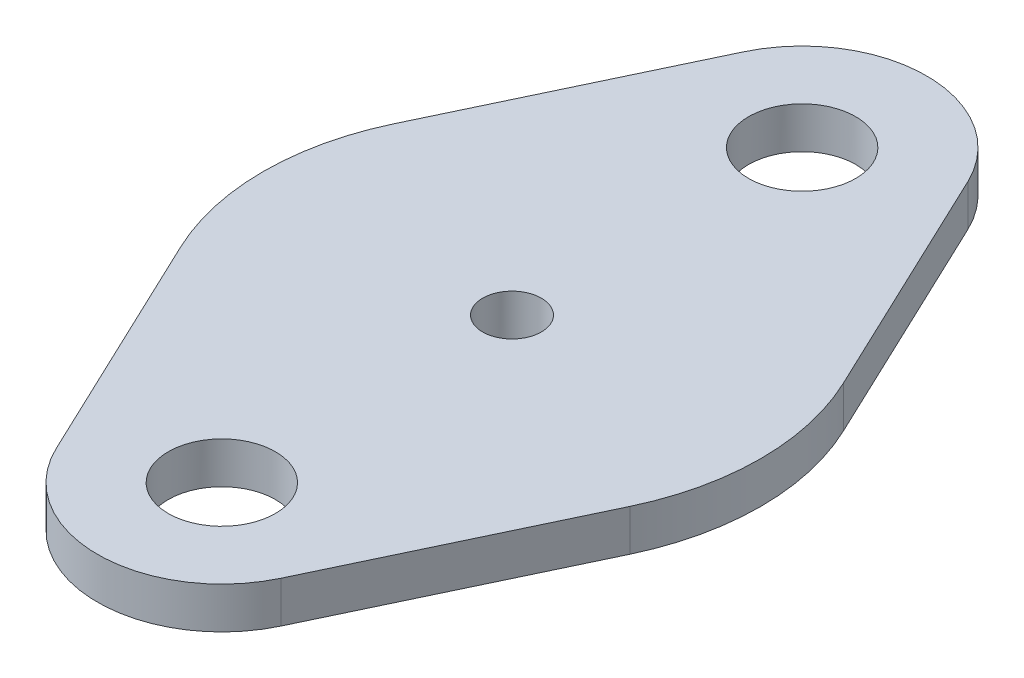
from build123d import *

# Parameters (mm, degrees)
SKETCH1_W                = 38.1
SKETCH1_H                = 63.5
BOSS_EXTRUDE1_DEPTH      = 3.175
F_8_CLEARANCE_HOLE1_D    = 4.4958
F_5_16_CLEARANCE_HOLE1_D = 8.2042
SKETCH6_W                = 40.64
SKETCH6_H                = 66.04
CUT_EXTRUDE1_DEPTH       = 3.175


with BuildPart() as part:
    # Sketch1 → Boss-Extrude1 (new body)
    with BuildSketch(Plane(origin=(0, 0, 0), x_dir=(1, 0, 0), z_dir=(0, 1, 0))):
        with Locations((19.05, 31.75)):
            Rectangle(SKETCH1_W, SKETCH1_H)
    extrude(amount=BOSS_EXTRUDE1_DEPTH)

    # #8 Clearance Hole1 (through all)
    with Locations(Plane(origin=(0, 3.175, 0), x_dir=(1, 0, 0), z_dir=(0, 1, 0))):
        with Locations((19.05, 31.75)):
            Hole(F_8_CLEARANCE_HOLE1_D / 2)

    # 5/16 Clearance Hole1 (through all)
    with Locations(Plane(origin=(0, 3.175, 0), x_dir=(1, 0, 0), z_dir=(0, 1, 0))):
        with Locations((19.05, 9.525), (19.05, 53.975)):
            Hole(F_5_16_CLEARANCE_HOLE1_D / 2)

    # Sketch6 → Cut-Extrude1 (cut)
    with BuildSketch(Plane(origin=(0, 3.175, 0), x_dir=(1, 0, 0), z_dir=(0, 1, 0))):
        with Locations((19.05, 31.75)):
            Rectangle(SKETCH6_W, SKETCH6_H)
        with BuildLine():
            Line((27.655912775, 58.057142857), (36.26182555, 39.914285714))
            ThreePointArc((36.26182555, 39.914285714), (38.1, 31.75), (36.26182555, 23.585714286))
            Line((36.26182555, 23.585714286), (27.655912775, 5.442857143))
            ThreePointArc((27.655912775, 5.442857143), (19.05, 0), (10.444087225, 5.442857143))
            Line((10.444087225, 5.442857143), (1.83817445, 23.585714286))
            ThreePointArc((1.83817445, 23.585714286), (0, 31.75), (1.83817445, 39.914285714))
            Line((1.83817445, 39.914285714), (10.444087225, 58.057142857))
            ThreePointArc((10.444087225, 58.057142857), (19.05, 63.5), (27.655912775, 58.057142857))
        make_face(mode=Mode.SUBTRACT)
    extrude(amount=-CUT_EXTRUDE1_DEPTH, mode=Mode.SUBTRACT)


solid = part.part
